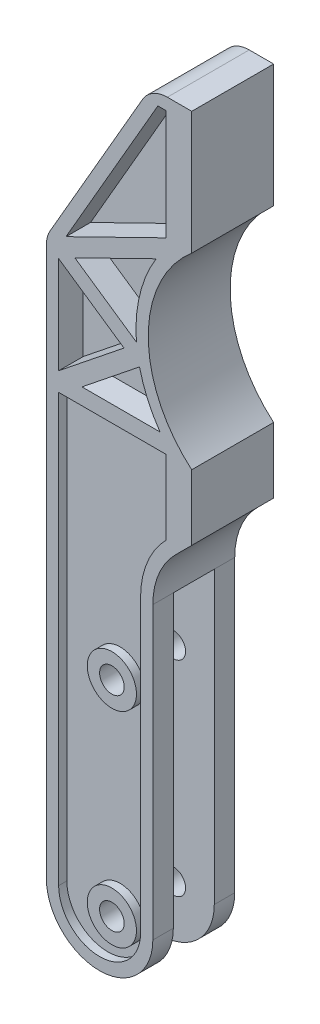
from build123d import *

# Parameters (mm, degrees)
SKETCH1_R           = 1.5
BOSS_EXTRUDE1_DEPTH = 5
CUT_EXTRUDE1_DEPTH  = 2.5
CUT_EXTRUDE3_DEPTH  = 1
SKETCH4_R           = 3
SKETCH4_R_2         = 1.5
EXTRUDE_THIN1_DEPTH = 1
CUT_EXTRUDE4_DEPTH  = 2
EXTRUDE_THIN2_REACH = 94.277
BOSS_EXTRUDE2_REACH = 94.277
FILLET1_R           = 3.5
BOSS_EXTRUDE8_DEPTH = 10


with BuildPart() as part:
    # Sketch1 → Boss-Extrude1 (new, symmetric)
    with BuildSketch(Plane.XY):
        with BuildLine():
            Line((0, 88.5), (-2, 86.5))
            Line((-2, 86.5), (0, 84.5))
            Line((0, 84.5), (-2, 82.5))
            Line((-2, 82.5), (0, 80.5))
            Line((0, 80.5), (-2, 78.5))
            Line((-2, 78.5), (0, 76.5))
            Line((0, 76.5), (0, 75))
            ThreePointArc((0, 75), (-5.309927761, 63.55), (0, 52.1))
            Line((0, 52.1), (-2, 50.1))
            Line((-2, 50.1), (0, 48.1))
            Line((0, 48.1), (-2, 46.1))
            Line((-2, 46.1), (0, 44.1))
            Line((0, 44.1), (-2, 42.1))
            ThreePointArc((-2, 42.1), (-4.035298286, 39.053960857), (-4.75, 35.460912703))
            Line((-4.75, 35.460912703), (-4.75, 0))
            ThreePointArc((-4.75, 0), (-11.25, -6.5), (-17.75, 0))
            Line((-17.75, 0), (-17.75, 67.916352203))
            Line((-17.75, 67.916352203), (-5, 90))
            Line((-5, 90), (0, 90))
            Line((0, 90), (0, 88.5))
        make_face()
        with Locations((-9.75, 0)):
            Circle(SKETCH1_R, mode=Mode.SUBTRACT)
        with Locations((-9.75, 25)):
            Circle(SKETCH1_R, mode=Mode.SUBTRACT)
    extrude(amount=BOSS_EXTRUDE1_DEPTH, both=True)

    # Sketch2 → Cut-Extrude1 (cut, symmetric)
    with BuildSketch(Plane.XY):
        with BuildLine():
            Line((-15, -8.410797367), (-15, 23.589202633))
            ThreePointArc((-15, 23.589202633), (-12.082951062, 31.431396204), (-4.75, 35.460912703))
            Line((-4.75, 35.460912703), (-4.75, -8.410797367))
            Line((-4.75, -8.410797367), (-15, -8.410797367))
        make_face()
    cut_extrude1 = extrude(amount=CUT_EXTRUDE1_DEPTH, both=True, mode=Mode.SUBTRACT)

    # Sketch3 → Cut-Extrude3 (cut)
    with BuildSketch(Plane.XY.offset(5)):
        with BuildLine():
            Line((-3.12764747, 88.5), (-4.133974596, 88.5))
            Line((-4.133974596, 88.5), (-16.25, 67.514428415))
            Line((-16.25, 67.514428415), (-16.25, 0))
            ThreePointArc((-16.25, 0), (-11.25, -5), (-6.25, 0))
            Line((-6.25, 0), (-6.25, 35.460912703))
            ThreePointArc((-6.25, 35.460912703), (-5.439227916, 39.583992212), (-3.12764747, 43.093084951))
            Line((-3.12764747, 43.093084951), (-3.12764747, 53.159809364))
            ThreePointArc((-3.12764747, 53.159809364), (-6.809927761, 63.55), (-3.12764747, 73.940190636))
            Line((-3.12764747, 73.940190636), (-3.12764747, 88.5))
        make_face()
    cut_extrude3 = extrude(amount=-CUT_EXTRUDE3_DEPTH, mode=Mode.SUBTRACT)

    # Sketch4 → Extrude-Thin1 (add)
    # profile 1 of 2: a face of its own
    with BuildSketch(Plane.XY.offset(4)):
        with Locations((-9.75, 25)):
            Circle(SKETCH4_R)
        with Locations((-9.75, 25)):
            Circle(SKETCH4_R_2, mode=Mode.SUBTRACT)
    # profile 2 of 2: a face of its own
    with BuildSketch(Plane.XY.offset(4)):
        with Locations((-9.75, 0)):
            Circle(SKETCH4_R)
        with Locations((-9.75, 0)):
            Circle(SKETCH4_R_2, mode=Mode.SUBTRACT)
    extrude_thin1 = extrude(amount=EXTRUDE_THIN1_DEPTH)

    # Sketch5 → Cut-Extrude4 (cut)
    with BuildSketch(Plane.XY.offset(4)):
        with BuildLine():
            Line((-16.25, 53.159809364), (-3.12764747, 53.159809364))
            ThreePointArc((-3.12764747, 53.159809364), (-6.809927761, 63.55), (-3.12764747, 73.940190636))
            Line((-3.12764747, 73.940190636), (-3.12764747, 88.5))
            Line((-3.12764747, 88.5), (-4.133974596, 88.5))
            Line((-4.133974596, 88.5), (-16.25, 67.514428415))
            Line((-16.25, 67.514428415), (-16.25, 53.159809364))
        make_face()
    cut_extrude4 = extrude(amount=-CUT_EXTRUDE4_DEPTH, mode=Mode.SUBTRACT)

    # Sketch6 → Extrude-Thin2 (add, up to next)
    with BuildSketch(Plane.XY.offset(5), mode=Mode.PRIVATE) as extrude_thin2_sk1:
        Polygon((-3.12764747, 54.159809364), (-13.401600212, 54.159809364), (-4.917118083, 60.954664271), (-14.27124031, 67.369931467), (-2.68786351, 73.042087041), (-3.56743143, 74.838294232), (-18.22875969, 67.658925362), (-8.271898443, 60.830286203), (-19.098399788, 52.159809364), (-3.12764747, 52.159809364), align=None)
    extrude_thin2_tool1 = extrude(extrude_thin2_sk1.sketch, amount=-EXTRUDE_THIN2_REACH, mode=Mode.PRIVATE) - part.part
    extrude_thin2 = extrude_thin2_tool1.solids().sort_by_distance((-8.264624, 53.879877, 5))[0]
    add(extrude_thin2)

    # Sketch7 → Boss-Extrude2 (add, up to next)
    with BuildSketch(Plane.XY.offset(5), mode=Mode.PRIVATE) as boss_extrude2_sk1:
        Polygon((-3.12764747, 73.940190636), (-3.56743143, 74.838294232), (-3.12764747, 75.053647931), align=None)
    boss_extrude2_tool1 = extrude(boss_extrude2_sk1.sketch, amount=-BOSS_EXTRUDE2_REACH, mode=Mode.PRIVATE) - part.part
    boss_extrude2 = boss_extrude2_tool1.solids().sort_by_distance((-3.274242, 74.610711, 5))[0]
    add(boss_extrude2)

    # Mirror2: Cut-Extrude1, Cut-Extrude3, Extrude-Thin1, Cut-Extrude4, Extrude-Thin2, Boss-Extrude2 across plane
    add(cut_extrude1.mirror(Plane.XY), mode=Mode.SUBTRACT)
    add(cut_extrude3.mirror(Plane.XY), mode=Mode.SUBTRACT)
    add(extrude_thin1.mirror(Plane.XY))
    add(cut_extrude4.mirror(Plane.XY), mode=Mode.SUBTRACT)
    add(extrude_thin2.mirror(Plane.XY))
    add(boss_extrude2.mirror(Plane.XY))

    # Fillet1
    fillet1_edges = [part.edges().sort_by_distance(p)[0] for p in [
        (-17.75, 67.916352203, 0),
        (-5, 90, 0),
    ]]
    fillet(fillet1_edges, radius=FILLET1_R)

    # Sketch11 → Boss-Extrude8 (add)
    with BuildSketch(Plane.XY.offset(5)):
        Polygon((0, 84.5), (0, 88.5), (-2, 86.5), align=None)
        Polygon((0, 80.5), (0, 84.5), (-2, 82.5), align=None)
        Polygon((0, 76.5), (0, 80.5), (-2, 78.5), align=None)
        Polygon((0, 48.1), (0, 52.1), (-2, 50.1), align=None)
        Polygon((0, 44.1), (0, 48.1), (-2, 46.1), align=None)
    extrude(amount=-BOSS_EXTRUDE8_DEPTH)


solid = part.part
